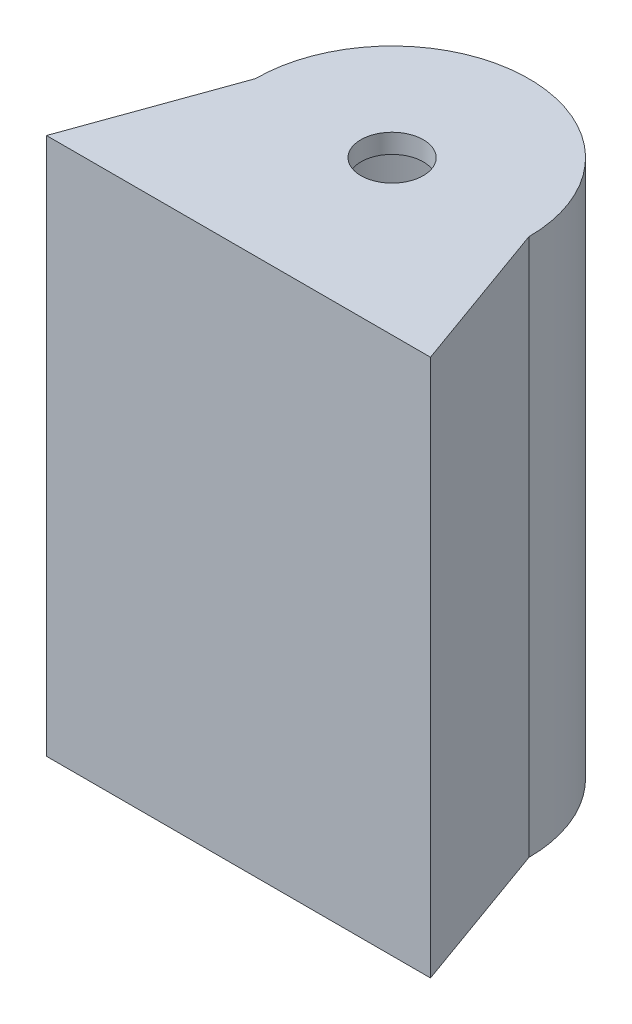
from build123d import *

# Parameters (mm, degrees)
SKETCH2_R           = 12.75
BOSS_EXTRUDE1_DEPTH = 56
SKETCH3_R           = 12.75
SKETCH3_R_2         = 3.25
BOSS_EXTRUDE2_DEPTH = 2


with BuildPart() as part:
    # Sketch2 → Boss-Extrude1 (new body)
    with BuildSketch(Plane(origin=(0, 0, 0), x_dir=(1, 0, 0), z_dir=(0, 1, 0))):
        with BuildLine():
            Line((-20, -16), (20, -16))
            Line((20, -16), (14.25, 0))
            ThreePointArc((14.25, 0), (0, 14.25), (-14.25, 0))
            Line((-14.25, 0), (-20, -16))
        make_face()
        with Locations(Location((0, 0, 0), (0, 0, 270))):
            Circle(SKETCH2_R, mode=Mode.SUBTRACT)
    extrude(amount=-BOSS_EXTRUDE1_DEPTH)

    # Sketch3 → Boss-Extrude2 (add)
    with BuildSketch(Plane(origin=(0, 0, 0), x_dir=(1, 0, 0), z_dir=(0, 1, 0))):
        with Locations(Location((0, 0, 0), (0, 0, 270))):
            Circle(SKETCH3_R)
        with Locations(Location((0, 0, 0), (0, 0, 270))):
            Circle(SKETCH3_R_2, mode=Mode.SUBTRACT)
    extrude(amount=-BOSS_EXTRUDE2_DEPTH)


solid = part.part
